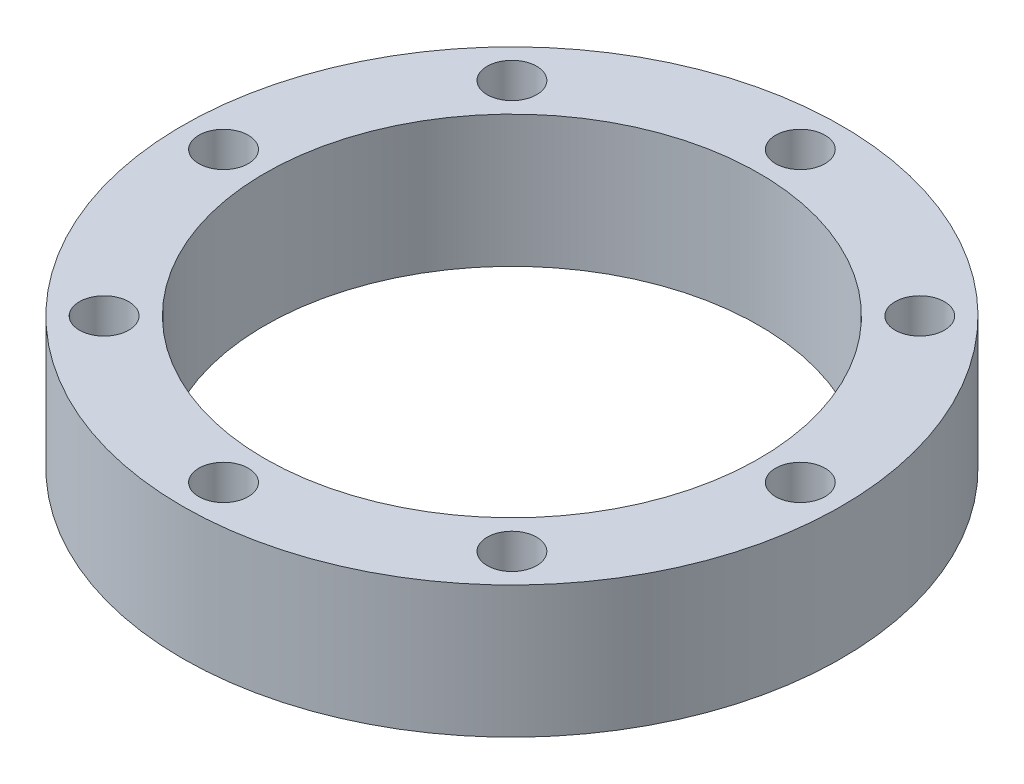
from build123d import *

# Parameters (mm, degrees)
SKETCH_1_R      = 20
SKETCH_1_R_2    = 15
SKETCH_1_R_3    = 1.5
EXTRUDE_1_DEPTH = 8


with BuildPart() as part:
    # 草图1 → 凸台-拉伸1 (new body)
    with BuildSketch(Plane(origin=(0, 0, 0), x_dir=(1, 0, 0), z_dir=(0, 1, 0))):
        with Locations(Location((0, 0, 0), (0, 0, 270))):
            Circle(SKETCH_1_R)
        with Locations(Location((0, 0, 0), (0, 0, 270))):
            Circle(SKETCH_1_R_2, mode=Mode.SUBTRACT)
        with Locations(Location((0, 17.5, 0), (0, 0, 270))):
            Circle(SKETCH_1_R_3, mode=Mode.SUBTRACT)
        with Locations(Location((12.374368671, 12.374368671, 0), (0, 0, 270))):
            Circle(SKETCH_1_R_3, mode=Mode.SUBTRACT)
        with Locations(Location((17.5, 0, 0), (0, 0, 270))):
            Circle(SKETCH_1_R_3, mode=Mode.SUBTRACT)
        with Locations(Location((12.374368671, -12.374368671, 0), (0, 0, 270))):
            Circle(SKETCH_1_R_3, mode=Mode.SUBTRACT)
        with Locations(Location((0, -17.5, 0), (0, 0, 270))):
            Circle(SKETCH_1_R_3, mode=Mode.SUBTRACT)
        with Locations(Location((-12.374368671, -12.374368671, 0), (0, 0, 270))):
            Circle(SKETCH_1_R_3, mode=Mode.SUBTRACT)
        with Locations(Location((-17.5, 0, 0), (0, 0, 270))):
            Circle(SKETCH_1_R_3, mode=Mode.SUBTRACT)
        with Locations(Location((-12.374368671, 12.374368671, 0), (0, 0, 270))):
            Circle(SKETCH_1_R_3, mode=Mode.SUBTRACT)
    extrude(amount=EXTRUDE_1_DEPTH)


solid = part.part
